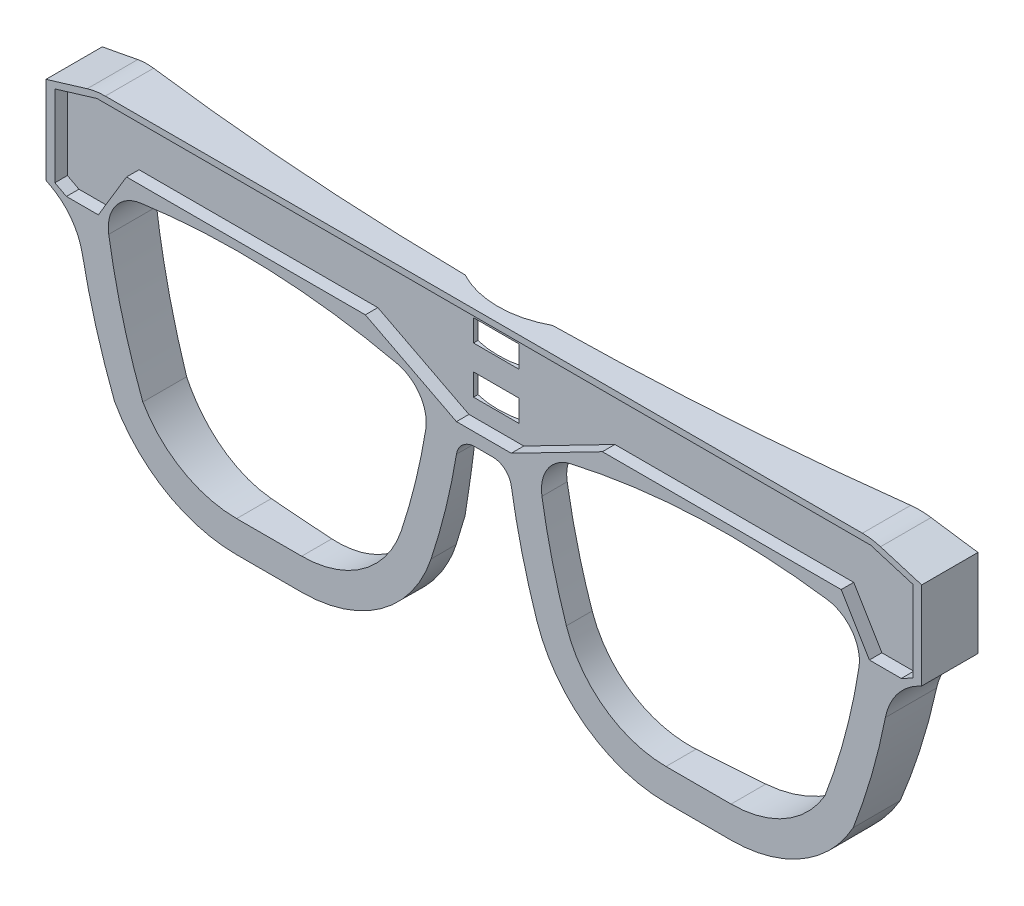
from build123d import *

# Parameters (mm, degrees)
BOSS_EXTRUDE1_DEPTH  = 9
CUT_EXTRUDE1_DEPTH   = 79.339006887
FILLET1_R            = 6
FILLET4_R            = 3
FILLET5_R            = 10
FILLET1_OF_MIRROR2_R = 6
FILLET4_OF_MIRROR2_R = 3
FILLET5_OF_MIRROR2_R = 10
CUT_EXTRUDE2_DEPTH   = 2
SKETCH4_W            = 7.3
SKETCH4_H            = 3.5
CUT_EXTRUDE3_DEPTH   = 79.134499565
CUT_EXTRUDE4_DEPTH   = 89.260976804


with BuildPart() as part:
    # Sketch1 → Boss-Extrude1 (new body)
    with BuildSketch(Plane.XY):
        with BuildLine():
            Line((-70, 16.58258549), (-70, 2.58258549))
            Line((-70, 2.58258549), (-65, -0.035347018))
            ThreePointArc((-65, -0.035347018), (-62.639321295, -11.428715409), (-59.057390955, -22.499009997))
            ThreePointArc((-59.057390955, -22.499009997), (-50.858075368, -30.911196539), (-39.524366721, -34))
            Line((-39.524366721, -34), (-29.119439011, -34))
            ThreePointArc((-29.119439011, -34), (-16.364659062, -29.873537236), (-8.443933007, -19.058075838))
            ThreePointArc((-8.443933007, -19.058075838), (-5.792248942, -9.629238804), (-4, 0))
            Line((-4, 0), (0, 0))
            Line((0, 0), (0, 19))
            Line((0, 19), (-62, 19))
            Line((-62, 19), (-70, 16.58258549))
        make_face()
    boss_extrude1 = extrude(amount=BOSS_EXTRUDE1_DEPTH)

    # Sketch2 → Cut-Extrude1 (cut, through all)
    with BuildSketch(Plane.XY.offset(9)):
        with BuildLine():
            Line((-39.524366721, -29), (-29.119439011, -29))
            ThreePointArc((-29.119439011, -29), (-19.293350153, -25.821035725), (-13.191343035, -17.488968441))
            ThreePointArc((-13.191343035, -17.488968441), (-10.661621804, -8.493805879), (-8.951806424, 0.692541077))
            ThreePointArc((-8.951806424, 0.692541077), (-8.83111114, 2.375291538), (-8.93749946, 4.05900707))
            ThreePointArc((-8.93749946, 4.05900707), (-33.987475013, 7.999161751), (-59.288689209, 6.303681198))
            ThreePointArc((-59.288689209, 6.303681198), (-60.075532666, 3.563074376), (-60.056140486, 0.711816353))
            ThreePointArc((-60.056140486, 0.711816353), (-57.852345066, -9.972645379), (-54.521869403, -20.361214511))
            ThreePointArc((-54.521869403, -20.361214511), (-48.178176596, -26.685865227), (-39.524366721, -29))
        make_face()
    cut_extrude1 = extrude(amount=-CUT_EXTRUDE1_DEPTH, mode=Mode.SUBTRACT)

    # Fillet1
    fillet1_edges = [part.edges().sort_by_distance(p)[0] for p in [
        (-8.93749946, 4.05900707, 4.5),
        (-59.288689209, 6.303681198, 4.5),
    ]]
    fillet(fillet1_edges, radius=FILLET1_R)

    # Fillet4
    fillet4_edges = [part.edges().sort_by_distance(p)[0] for p in [
        (-4, 0, 4.5),
    ]]
    fillet(fillet4_edges, radius=FILLET4_R)

    # Fillet5
    fillet5_edges = [part.edges().sort_by_distance(p)[0] for p in [
        (-65, -0.035347018, 4.5),
        (-62, 19, 4.5),
    ]]
    fillet(fillet5_edges, radius=FILLET5_R)

    # Mirror2: Boss-Extrude1, Cut-Extrude1 across plane
    add(boss_extrude1.mirror(Plane(origin=(0, 19, 9), x_dir=(0, 0, 1), z_dir=(1, 0, 0))))
    add(cut_extrude1.mirror(Plane(origin=(0, 19, 9), x_dir=(0, 0, 1), z_dir=(1, 0, 0))), mode=Mode.SUBTRACT)

    # Fillet1 of Mirror2
    fillet1_of_mirror2_edges = [part.edges().sort_by_distance(p)[0] for p in [
        (8.93749946, 4.05900707, 4.5),
        (59.288689209, 6.303681198, 4.5),
    ]]
    fillet(fillet1_of_mirror2_edges, radius=FILLET1_OF_MIRROR2_R)

    # Fillet4 of Mirror2
    fillet4_of_mirror2_edges = [part.edges().sort_by_distance(p)[0] for p in [
        (4, 0, 4.5),
    ]]
    fillet(fillet4_of_mirror2_edges, radius=FILLET4_OF_MIRROR2_R)

    # Fillet5 of Mirror2
    fillet5_of_mirror2_edges = [part.edges().sort_by_distance(p)[0] for p in [
        (65, -0.035347018, 4.5),
        (62, 19, 4.5),
    ]]
    fillet(fillet5_of_mirror2_edges, radius=FILLET5_OF_MIRROR2_R)

    # Sketch3 → Cut-Extrude2 (cut)
    with BuildSketch(Plane.XY.offset(9)):
        Polygon((-68.579000582, 15.967320332), (-61.852211578, 18), (61.852211578, 18), (68.579000582, 15.967320332), (68.579000582, 2.967348727), (66.731457293, 2), (61.632252323, 2), (57.126911514, 9.5), (18.95111491, 9.5), (4.382114171, 2), (-4.382114171, 2), (-18.95111491, 9.5), (-57.126911514, 9.5), (-61.632252323, 2), (-66.731457293, 2), (-68.579000582, 2.967348727), align=None)
    extrude(amount=-CUT_EXTRUDE2_DEPTH, mode=Mode.SUBTRACT)

    # Sketch4 → Cut-Extrude3 (cut, through all)
    with BuildSketch(Plane.XY.offset(7)):
        with Locations((0, 14)):
            Rectangle(SKETCH4_W, SKETCH4_H)
        with Locations((0, 6.5)):
            Rectangle(SKETCH4_W, SKETCH4_H)
    extrude(amount=-CUT_EXTRUDE3_DEPTH, mode=Mode.SUBTRACT)

    # Sketch5 → Cut-Extrude4 (cut, through all)
    with BuildSketch(Plane(origin=(0, 19, 0), x_dir=(1, 0, 0), z_dir=(0, 1, 0))):
        with BuildLine():
            Line((-70, 0), (70, 0))
            ThreePointArc((70, 0), (38.581705318, -3.529487002), (7, -5))
            ThreePointArc((7, -5), (0, -6.753122833), (-7, -5))
            ThreePointArc((-7, -5), (-38.581705318, -3.529487002), (-70, 0))
        make_face()
    extrude(amount=-CUT_EXTRUDE4_DEPTH, mode=Mode.SUBTRACT)


solid = part.part
